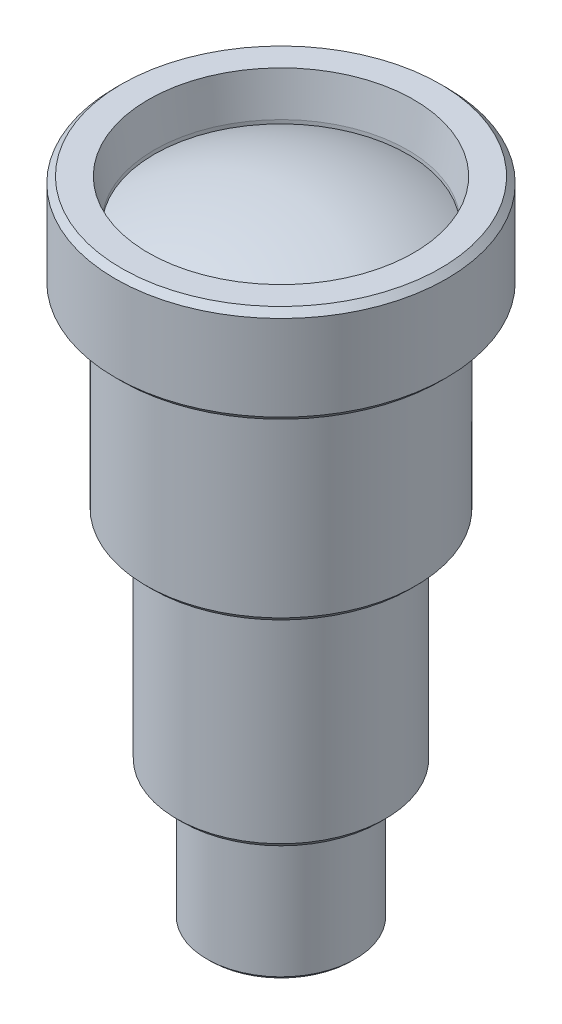
from build123d import *

# Parameters (mm, degrees)
SCALE1_SCALE = 0.502986482


with BuildPart() as part:
    # Model → Revolve1 (revolve)
    with BuildSketch(Plane.XY):
        with BuildLine():
            Line((28.595574, 124.840746), (28.595574, 131.228004974))
            ThreePointArc((28.595574, 131.228004974), (28.89122421, 131.392844904), (29.188156, 131.555364935))
            Line((29.188156, 131.555364935), (29.188156, 132.16509))
            Line((29.188156, 132.16509), (28.193238, 138.747754))
            Line((28.193238, 138.747754), (23.8331756, 138.747754))
            Line((23.8331756, 138.747754), (22.8382322, 137.752582))
            Line((22.8382322, 137.752582), (22.8382322, 123.845828))
            Line((22.8382322, 123.845828), (23.8331756, 122.850656))
            Line((23.8331756, 122.850656), (25.61082, 122.850656))
            Line((25.61082, 122.850656), (25.61082, 131.570984))
            Line((25.61082, 131.570984), (26.605738, 131.570984))
            Line((26.605738, 131.570984), (26.605738, 123.8885))
            Line((26.605738, 123.8885), (27.813, 123.040902))
            Line((27.813, 123.040902), (27.813, 92.032328))
            Line((27.813, 92.032328), (28.807918, 91.03741))
            Line((28.807918, 91.03741), (32.78632, 91.03741))
            Line((32.78632, 91.03741), (32.78632, 56.684418))
            Line((32.78632, 56.684418), (33.781238, 55.689246))
            Line((33.781238, 55.689246), (38.64991, 55.689246))
            Line((38.64991, 55.689246), (38.64991, 54.101746))
            Line((38.64991, 54.101746), (38.353746, 54.101746))
            Line((38.353746, 54.101746), (37.740082, 53.509418))
            Line((37.740082, 53.509418), (37.740082, 34.416492))
            Line((37.740082, 34.416492), (38.353746, 33.82391))
            Line((38.353746, 33.82391), (39.644828, 33.82391))
            Line((39.644828, 33.82391), (39.644828, 56.684418))
            Line((39.644828, 56.684418), (34.776156, 56.684418))
            Line((34.776156, 56.684418), (34.776156, 94.297754))
            Line((34.776156, 94.297754), (29.993082, 94.297754))
            Line((29.993082, 94.297754), (29.993082, 124.840746))
            Line((29.993082, 124.840746), (28.595574, 124.840746))
        make_face()
    revolve(axis=Axis((49.796303883, 136.783225344, 0), (0, -1, 0)))

    # Model<3> → Revolve2 (revolve)
    with BuildSketch(Plane.XY):
        with BuildLine():
            ThreePointArc((29.188156, 131.555364935), (28.89122421, 131.392844904), (28.595574, 131.228004974))
            Line((28.595574, 131.228004974), (49.796303883, 135.136111003))
            Line((49.796303883, 135.136111003), (49.796303883, 136.783225344))
            ThreePointArc((49.796303883, 136.783225344), (39.165849005, 135.455883929), (29.188156, 131.555364935))
        make_face()
    revolve(axis=Axis((49.796303883, 136.783225344, 0), (0, -1, 0)))


with BuildPart() as part_1:
    # Scale1: scaled about (49.796303883, 104.576694566, 0)
    add(part.part.scale(SCALE1_SCALE).moved(Location((24.749436164, 51.976030842, 0))))


solid = part_1.part
